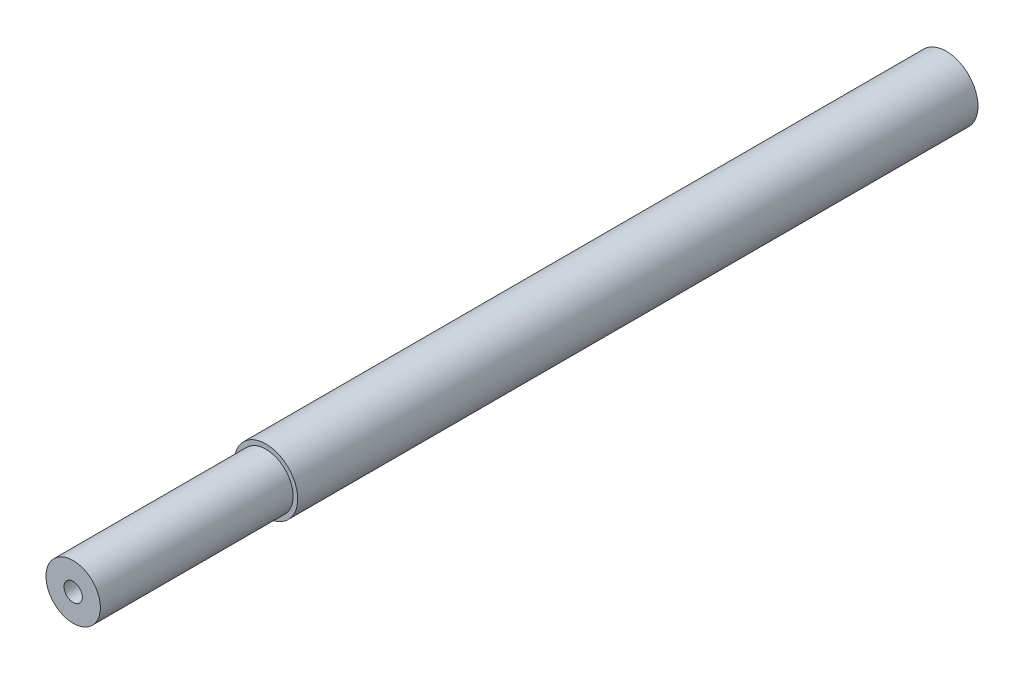
from build123d import *

# Parameters (mm, degrees)
SKETCH2_R          = 2.0193
CUT_EXTRUDE1_DEPTH = 25


with BuildPart() as part:
    # Sketch1 → Revolve1 (revolve)
    with BuildSketch(Plane(origin=(0, 0, 0), x_dir=(0, 0, -1), z_dir=(1, 0, 0)), mode=Mode.PRIVATE) as revolve1_sk:
        Polygon((185, 0), (185, 7), (35, 7), (35, 6), (-7.5, 6), (-7.5, 0), align=None)
    revolve(revolve1_sk.sketch.rotate(Axis((0, 0, 0), (0, 0, -1)), 90), axis=Axis((0, 0, 0), (0, 0, -1)))

    # Sketch2 → Cut-Extrude1 (cut)
    with BuildSketch(Plane.XY.offset(7.5)):
        Circle(SKETCH2_R)
    extrude(amount=-CUT_EXTRUDE1_DEPTH, mode=Mode.SUBTRACT)


solid = part.part
